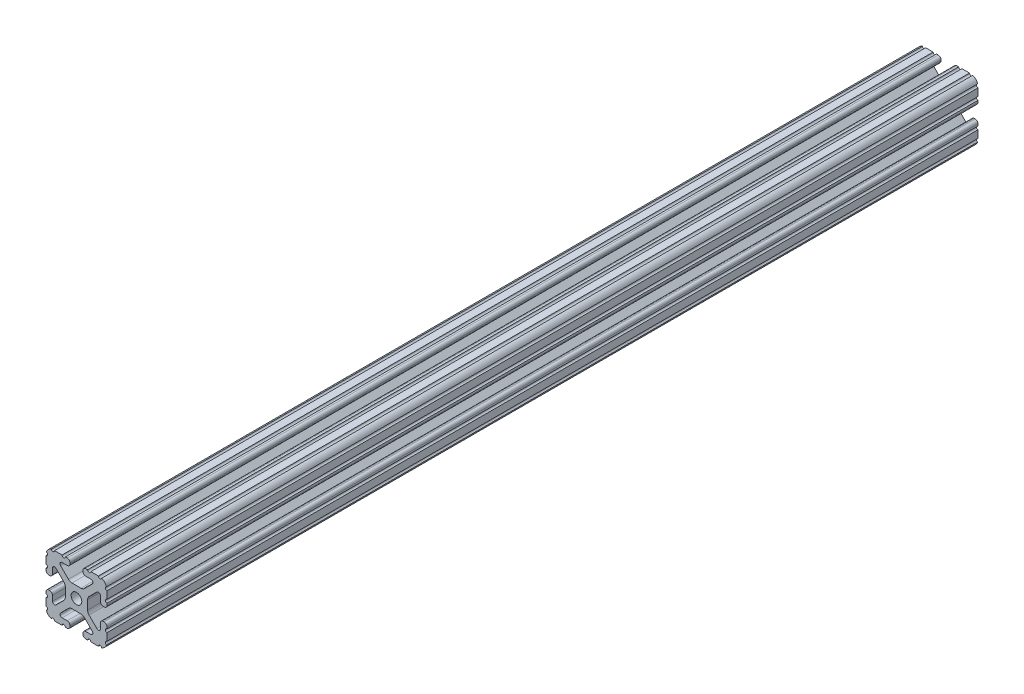
from build123d import *

# Parameters (mm, degrees)
BOSS_EXTRUDE1_DEPTH     = 272.5
CUT_EXTRUDE1_DEPTH      = 274.828513855
CUT_EXTRUDE1_DEPTH_BACK = 274.828513855
SKETCH5_R               = 1.016


with BuildPart() as part:
    # Sketch4 → Boss-Extrude1 (new, symmetric)
    with BuildSketch(Plane.XY):
        with BuildLine():
            Line((5.7912, -19.05), (14.3002, -19.05))
            ThreePointArc((14.3002, -19.05), (17.658815789, -17.658815789), (19.05, -14.3002))
            Line((19.05, -14.3002), (19.05, -5.7912))
            ThreePointArc((19.05, -5.7912), (18.544114832, -4.569885168), (17.3228, -4.064))
            Line((17.3228, -4.064), (16.7132, -4.064))
            ThreePointArc((16.7132, -4.064), (15.491885168, -4.569885168), (14.986, -5.7912))
            Line((14.986, -5.7912), (14.986, -8.996305235))
            ThreePointArc((14.986, -8.996305235), (14.189232738, -10.188751711), (12.782646215, -9.908964256))
            Line((12.782646215, -9.908964256), (7.888897763, -5.015215804))
            ThreePointArc((7.888897763, -5.015215804), (7.219915375, -4.014012907), (6.985, -2.833013566))
            Line((6.985, -2.833013566), (6.985, 0))
            Line((6.985, 0), (3.3274, 0))
            ThreePointArc((3.3274, 0), (2.352827104, -2.352827104), (0, -3.3274))
            Line((0, -3.3274), (0, -6.985))
            Line((0, -6.985), (2.833013566, -6.985))
            ThreePointArc((2.833013566, -6.985), (4.014012907, -7.219915375), (5.015215804, -7.888897763))
            Line((5.015215804, -7.888897763), (9.908964256, -12.782646215))
            ThreePointArc((9.908964256, -12.782646215), (10.188751711, -14.189232738), (8.996305235, -14.986))
            Line((8.996305235, -14.986), (5.7912, -14.986))
            ThreePointArc((5.7912, -14.986), (4.569885168, -15.491885168), (4.064, -16.7132))
            Line((4.064, -16.7132), (4.064, -17.3228))
            ThreePointArc((4.064, -17.3228), (4.569885168, -18.544114832), (5.7912, -19.05))
        make_face()
    extrude(amount=BOSS_EXTRUDE1_DEPTH, both=True)

    # Sketch5 → Cut-Extrude1 (cut, two sides: drawn at the far end of the back side and taken through both)
    with BuildSketch(Plane.XY.offset(-CUT_EXTRUDE1_DEPTH_BACK)):
        with Locations((14.739477062, -19.05)):
            Circle(SKETCH5_R)
        with Locations((7.980305235, -19.05)):
            Circle(SKETCH5_R)
        with Locations((19.05, -14.739477062)):
            Circle(SKETCH5_R)
        with Locations((19.05, -7.980305235)):
            Circle(SKETCH5_R)
    extrude(amount=CUT_EXTRUDE1_DEPTH + CUT_EXTRUDE1_DEPTH_BACK, mode=Mode.SUBTRACT)

    # Mirror1: part across plane


with BuildPart() as part_1:
    add(part.part)
    add(part.part.mirror(Plane(origin=(0, 0, 0), x_dir=(0, 0, 1), z_dir=(1, 0, 0))))

    # Mirror2: part across plane


with BuildPart() as part_2:
    add(part_1.part)
    add(part_1.part.mirror(Plane.ZX))


solid = part_2.part
